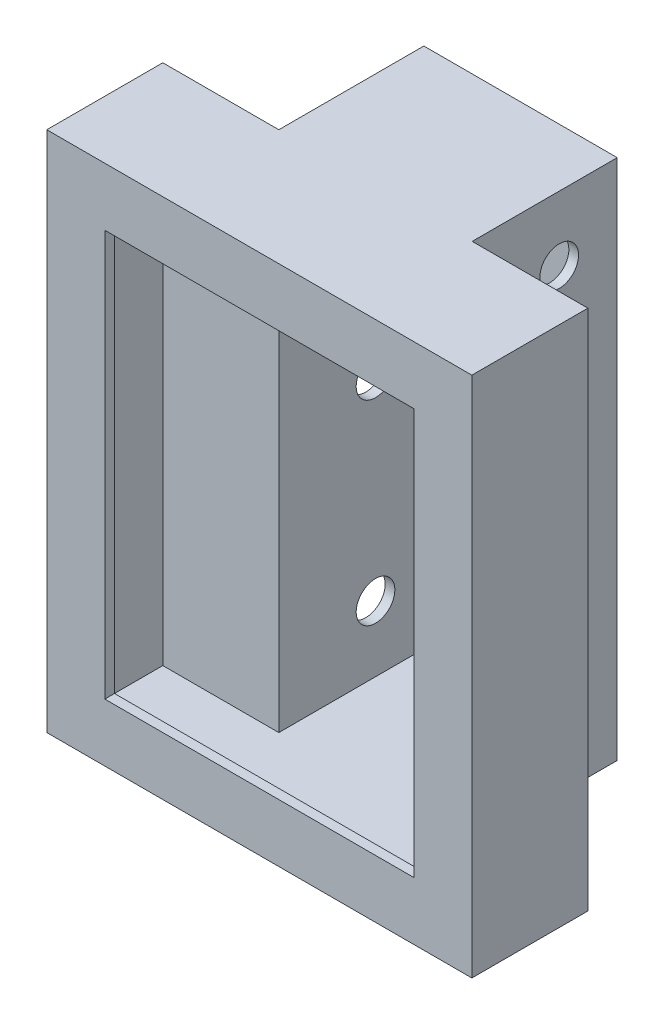
from build123d import *

# Parameters (mm, degrees)
ESQUISSE1_W             = 100
ESQUISSE1_H             = 270
BOSS_EXTRU_1_DEPTH      = 5
ESQUISSE2_W             = 100
ESQUISSE2_H             = 270
ESQUISSE2_W_2           = 90
ESQUISSE2_H_2           = 260
BOSS_EXTRU_2_DEPTH      = 70
ESQUISSE3_W             = 65
ESQUISSE3_H             = 270
BOSS_EXTRU_4_DEPTH      = 5
ESQUISSE5_W             = 90
ESQUISSE5_H             = 5
ESQUISSE5_W_2           = 89.831851537
BOSS_EXTRU_5_DEPTH      = 5
ESQUISSE6_W             = 219.831851537
ESQUISSE6_H             = 270
ESQUISSE6_W_2           = 209.831851537
ESQUISSE6_H_2           = 260
BOSS_EXTRU_6_DEPTH      = 50
ESQUISSE7_R             = 10
ENL_V_MAT_EXTRU_1_DEPTH = 340.626590193
ESQUISSE8_W             = 159.831851537
ESQUISSE8_H             = 210
BOSS_EXTRU_7_DEPTH      = 5


with BuildPart() as part:
    # Esquisse1 → Boss.-Extru.1 (new body)
    with BuildSketch(Plane.XY):
        with Locations((-50, 135)):
            Rectangle(ESQUISSE1_W, ESQUISSE1_H)
    extrude(amount=BOSS_EXTRU_1_DEPTH)

    # Esquisse2 → Boss.-Extru.2 (add)
    with BuildSketch(Plane.XY.offset(5)):
        with Locations((-50, 135)):
            Rectangle(ESQUISSE2_W, ESQUISSE2_H)
        with Locations((-50, 135)):
            Rectangle(ESQUISSE2_W_2, ESQUISSE2_H_2, mode=Mode.SUBTRACT)
    extrude(amount=BOSS_EXTRU_2_DEPTH)

    # Esquisse3 → Boss.-Extru.4 (add)
    with BuildSketch(Plane.XY.offset(75)):
        with Locations((-127.5, 135)):
            Rectangle(ESQUISSE3_W, ESQUISSE3_H)
        with Locations((27.331851537, 135)):
            Rectangle(ESQUISSE3_W, ESQUISSE3_H)
    extrude(amount=BOSS_EXTRU_4_DEPTH)

    # Esquisse5 → Boss.-Extru.5 (add)
    with BuildSketch(Plane.XY.offset(75)):
        with Locations((-50, 267.5)):
            Rectangle(ESQUISSE5_W, ESQUISSE5_H)
        with Locations((-50.084074231, 2.5)):
            Rectangle(ESQUISSE5_W_2, ESQUISSE5_H)
    extrude(amount=BOSS_EXTRU_5_DEPTH)

    # Esquisse6 → Boss.-Extru.6 (add)
    with BuildSketch(Plane.XY.offset(80)):
        with Locations((-50.084074231, 135)):
            Rectangle(ESQUISSE6_W, ESQUISSE6_H)
        with Locations((-50.084074231, 135)):
            Rectangle(ESQUISSE6_W_2, ESQUISSE6_H_2, mode=Mode.SUBTRACT)
    extrude(amount=BOSS_EXTRU_6_DEPTH)

    # Esquisse7 → Enlèv. mat.-Extru.1 (cut, through all)
    with BuildSketch(Plane.ZY.offset(100)):
        with Locations((30, 140)):
            Circle(ESQUISSE7_R)
        with Locations((30, 38.975952284)):
            Circle(ESQUISSE7_R)
        with Locations((30, 236.400600349)):
            Circle(ESQUISSE7_R)
    extrude(amount=-ENL_V_MAT_EXTRU_1_DEPTH, mode=Mode.SUBTRACT)

    # Esquisse8 → Boss.-Extru.7 (add)
    with BuildSketch(Plane.XY.offset(130)):
        Polygon((-160, 270), (-130, 270), (59.831851537, 270), (59.831851537, 240), (59.831851537, 0), (29.831851537, 0), (-130, 0), (-160, 0), align=None)
        with Locations((-50.084074231, 135)):
            Rectangle(ESQUISSE8_W, ESQUISSE8_H, mode=Mode.SUBTRACT)
    extrude(amount=BOSS_EXTRU_7_DEPTH)


solid = part.part
